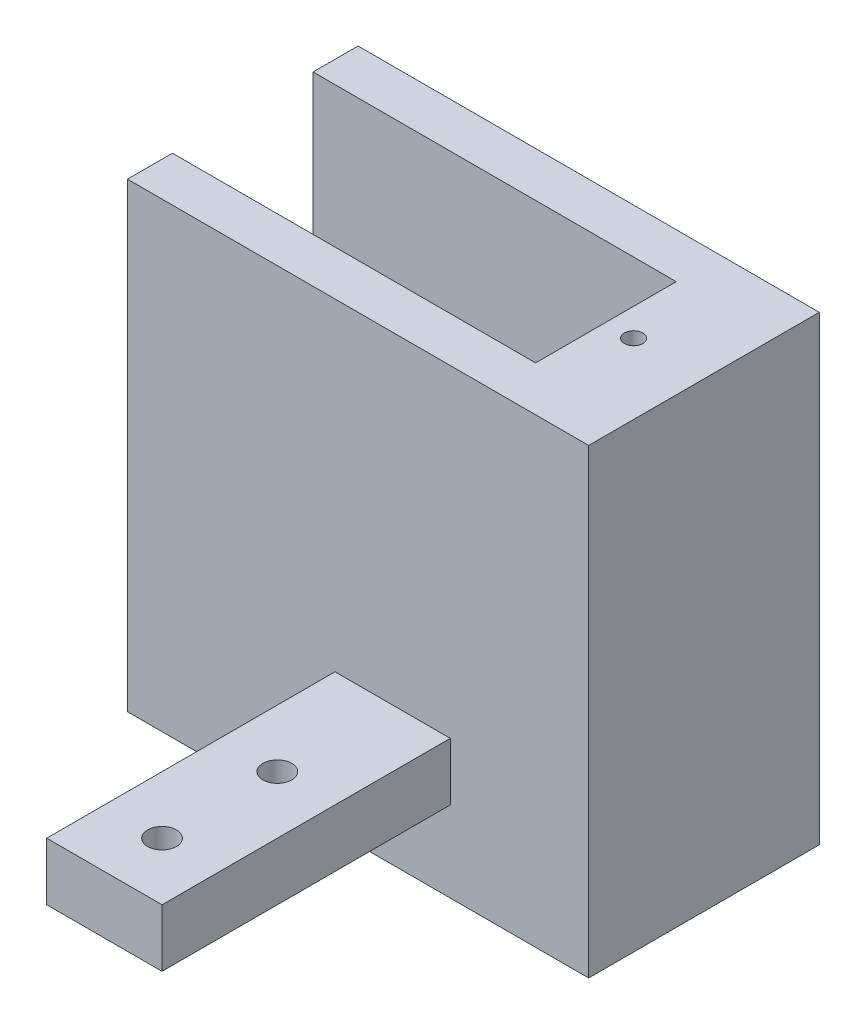
from build123d import *

# Parameters (mm, degrees)
SKETCH_2_W          = 40
SKETCH_2_H          = 40
EXTRUDE_1_DEPTH     = 10
SKETCH_3_W          = 50
SKETCH_3_H          = 16
CUT_EXTRUDE_1_DEPTH = 6.1
M2X0_4_1_D          = 1.6
M2X0_4_1_DEPTH      = 10
M2X0_4_1_TIP        = 0.480688495
SKETCH_13_W         = 10
SKETCH_13_H         = 5
EXTRUDE_5_DEPTH     = 25
M3X0_5_2_D          = 2.5
M3X0_5_2_DEPTH      = 8.5
M3X0_5_2_TIP        = 0.751075774


with BuildPart() as part:
    # ｽｹｯﾁ2 → ﾎﾞｽ - 押し出し1 (new body)
    with BuildSketch(Plane.XY):
        Rectangle(SKETCH_2_W, SKETCH_2_H)
    extrude_1 = extrude(amount=EXTRUDE_1_DEPTH)

    # ｽｹｯﾁ3 → ｶｯﾄ - 押し出し1 (cut)
    with BuildSketch(Plane.XY):
        with Locations((-13.5, 12)):
            Rectangle(SKETCH_3_W, SKETCH_3_H)
    cut_extrude_1 = extrude(amount=CUT_EXTRUDE_1_DEPTH, mode=Mode.SUBTRACT)

    # ﾐﾗｰ1: ﾎﾞｽ - 押し出し1, ｶｯﾄ - 押し出し1 across plane
    add(extrude_1.mirror(Plane.XY))
    add(cut_extrude_1.mirror(Plane.XY), mode=Mode.SUBTRACT)

    # M2x0.4 ねじ穴1
    with Locations(Plane(origin=(0, 20, 0), x_dir=(1, 0, 0), z_dir=(0, 1, 0))):
        with Locations((13.9, 0), (-13.9, 0)):
            Hole(M2X0_4_1_D / 2, depth=M2X0_4_1_DEPTH)
            with Locations((0, 0, -(M2X0_4_1_DEPTH + M2X0_4_1_TIP / 2))):  # 118° drill point
                Cone(0, M2X0_4_1_D / 2, M2X0_4_1_TIP, mode=Mode.SUBTRACT)

    # ｽｹｯﾁ13 → ﾎﾞｽ - 押し出し5 (add)
    with BuildSketch(Plane.XY.offset(10)):
        with Locations((3, -10.5)):
            Rectangle(SKETCH_13_W, SKETCH_13_H)
    extrude(amount=EXTRUDE_5_DEPTH)

    # M3x0.5 ねじ穴2
    with Locations(Plane(origin=(0, -13, 0), x_dir=(-1, 0, 0), z_dir=(0, -1, 0))):
        with Locations((-3, -20), (-3, -30)):
            Hole(M3X0_5_2_D / 2, depth=M3X0_5_2_DEPTH)
            with Locations((0, 0, -(M3X0_5_2_DEPTH + M3X0_5_2_TIP / 2))):  # 118° drill point
                Cone(0, M3X0_5_2_D / 2, M3X0_5_2_TIP, mode=Mode.SUBTRACT)


solid = part.part
